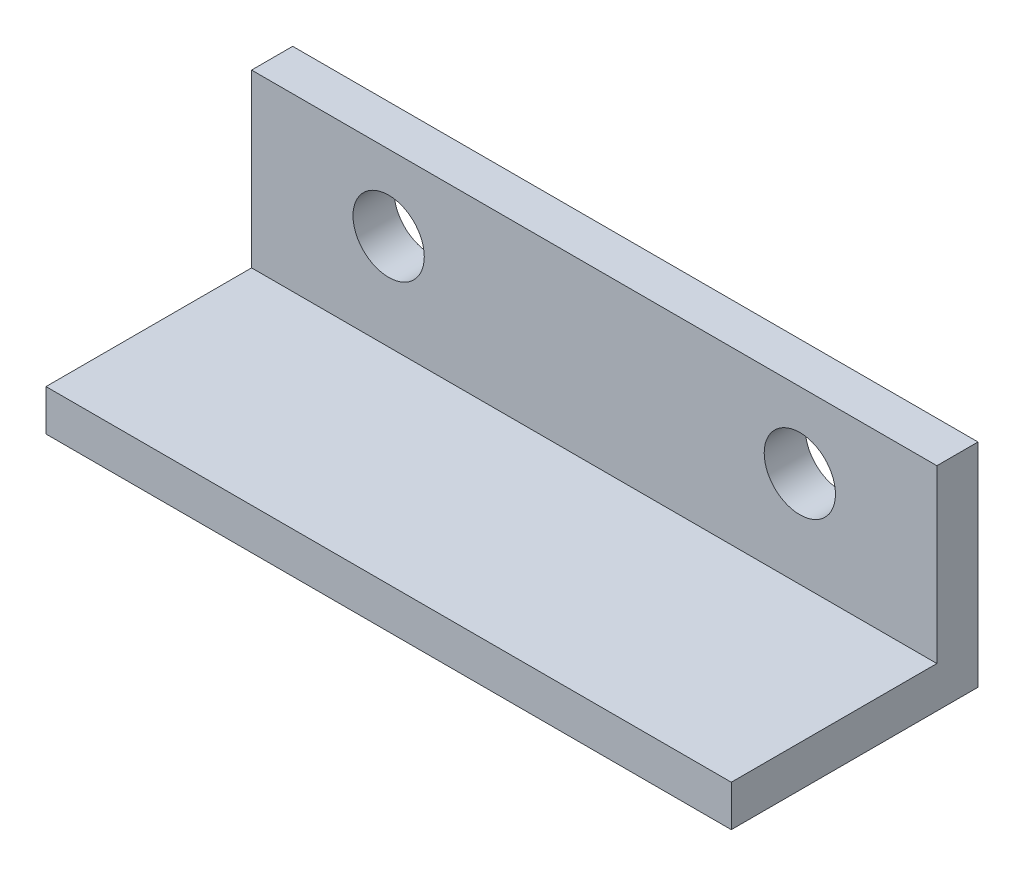
from build123d import *

# Parameters (mm, degrees)
IZIM1_W                              = 50
IZIM1_H                              = 18
IZIM1_R                              = 2.001074691
IZIM1_R_2                            = 2.688724503
Y_KSEKLIK_EKSTR_ZYON1_DEPTH          = 3
M5_HELISARMAL_I_IN_Z_VANA_MATKAB_1_D = 5.2
IZIM4_W                              = 50
IZIM4_H                              = 3
Y_KSEKLIK_EKSTR_ZYON2_DEPTH          = 15
IZIM5_W                              = 50
IZIM5_H                              = 2.5
KES_EKSTR_ZYON1_DEPTH                = 15


with BuildPart() as part:
    # Çizim1 → Yükseklik-Ekstrüzyon1 (new body)
    # profile 1 of 3: a face of its own
    with BuildSketch(Plane.XY):
        with Locations((10.655737705, -2.06557377)):
            Rectangle(IZIM1_W, IZIM1_H)
        with Locations((25.655737705, -1.06557377)):
            Circle(IZIM1_R, mode=Mode.SUBTRACT)
        with Locations((-4.344262295, -1.06557377)):
            Circle(IZIM1_R_2, mode=Mode.SUBTRACT)
    # profile 2 of 3: a face of its own
    with BuildSketch(Plane.XY):
        with Locations((25.655737705, -1.06557377)):
            Circle(IZIM1_R)
    # profile 3 of 3: a face of its own
    with BuildSketch(Plane.XY):
        with Locations((-4.344262295, -1.06557377)):
            Circle(IZIM1_R_2)
    extrude(amount=Y_KSEKLIK_EKSTR_ZYON1_DEPTH)

    # M5 Helisarmal için Zıvana matkabı1 (through all)
    with Locations(Plane(origin=(0, 0, 0), x_dir=(-1, 0, 0), z_dir=(0, 0, -1))):
        with Locations((-25.655737705, -1.06557377), (4.344262295, -1.06557377)):
            Hole(M5_HELISARMAL_I_IN_Z_VANA_MATKAB_1_D / 2)

    # Çizim4 → Yükseklik-Ekstrüzyon2 (add)
    with BuildSketch(Plane.XY.offset(3)):
        with Locations((10.655737705, -9.56557377)):
            Rectangle(IZIM4_W, IZIM4_H)
    extrude(amount=Y_KSEKLIK_EKSTR_ZYON2_DEPTH)

    # Çizim5 → Kes-Ekstrüzyon1 (cut)
    with BuildSketch(Plane.XY.offset(3)):
        with Locations((10.655737705, 5.68442623)):
            Rectangle(IZIM5_W, IZIM5_H)
    extrude(amount=-KES_EKSTR_ZYON1_DEPTH, mode=Mode.SUBTRACT)


solid = part.part
